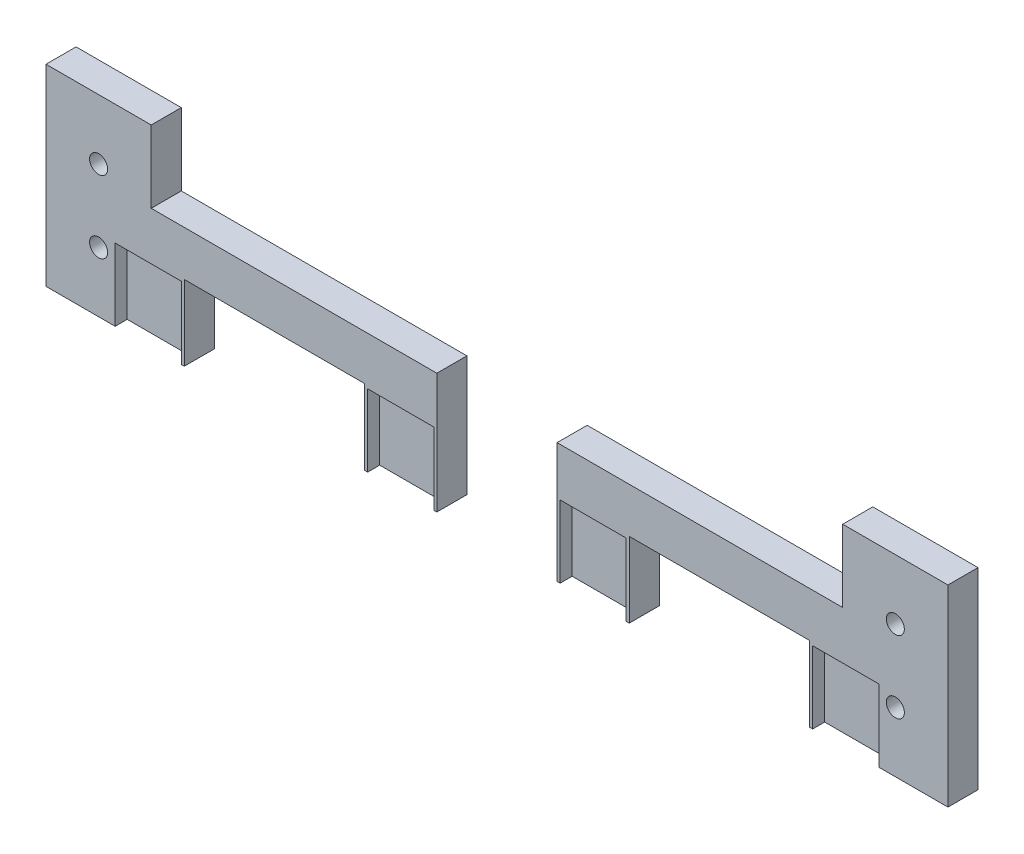
from build123d import *

# Parameters (mm, degrees)
SKETCH1_R           = 1.5
BOSS_EXTRUDE1_DEPTH = 5
SKETCH2_W           = 11
SKETCH2_H           = 12
CUT_EXTRUDE1_DEPTH  = 2


with BuildPart() as part:
    # Sketch1 → Boss-Extrude1 (new body)
    with BuildSketch(Plane.XY):
        Polygon((56.25, 8), (8.75, 8), (8.75, 20), (-8.75, 20), (-8.75, -12), (14.25, -12), (14.25, 0.5), (44.25, 0.5), (44.25, -12), (56.25, -12), align=None)
        with Locations((0, -2)):
            Circle(SKETCH1_R, mode=Mode.SUBTRACT)
        with Locations((0, 10)):
            Circle(SKETCH1_R, mode=Mode.SUBTRACT)
    extrude(amount=BOSS_EXTRUDE1_DEPTH)

    # Sketch2 → Cut-Extrude1 (cut)
    with BuildSketch(Plane.XY.offset(5)):
        with Locations((50.25, -6)):
            Rectangle(SKETCH2_W, SKETCH2_H)
        with Locations((8.25, -6)):
            Rectangle(SKETCH2_W, SKETCH2_H)
    extrude(amount=-CUT_EXTRUDE1_DEPTH, mode=Mode.SUBTRACT)


with BuildPart() as body_2:
    # Mirror2: mirrored copy
    add(part.part.mirror(Plane(origin=(66.25, 0, 0), x_dir=(0, 0, 1), z_dir=(1, 0, 0))))


solid = Compound([part.part, body_2.part])
